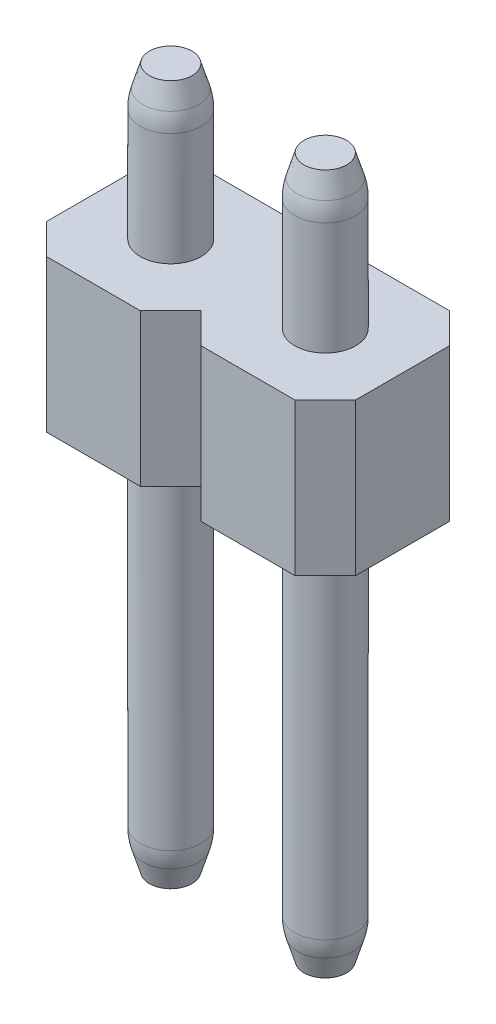
from build123d import *
from OCP.BRepFilletAPI import BRepFilletAPI_MakeChamfer

# Parameters (mm, degrees)
SKETCH1_R               = 0.5
BOSS_EXTRUDE1_DEPTH     = 11.5
BOSS_EXTRUDE1_2_DEPTH   = 11.5
BOSS_EXTRUDE1_3_DEPTH   = 11.5
BOSS_EXTRUDE1_4_DEPTH   = 11.5
BOSS_EXTRUDE1_5_DEPTH   = 11.5
BOSS_EXTRUDE1_6_DEPTH   = 11.5
BOSS_EXTRUDE1_7_DEPTH   = 11.5
BOSS_EXTRUDE1_8_DEPTH   = 11.5
BOSS_EXTRUDE1_9_DEPTH   = 11.5
BOSS_EXTRUDE1_10_DEPTH  = 11.5
BOSS_EXTRUDE1_11_DEPTH  = 11.5
BOSS_EXTRUDE1_12_DEPTH  = 11.5
BOSS_EXTRUDE1_13_DEPTH  = 11.5
BOSS_EXTRUDE1_14_DEPTH  = 11.5
BOSS_EXTRUDE1_15_DEPTH  = 11.5
BOSS_EXTRUDE1_16_DEPTH  = 11.5
BOSS_EXTRUDE2_DEPTH     = 2.5
CHAMFER1_SIZE           = 0.5
CHAMFER1_SIZE2          = 0.15
FILLET1_R               = 1
CHAMFER2_SIZE           = 0.15
CHAMFER2_SIZE2          = 0.5
FILLET2_R               = 1
CUT_EXTRUDE1_DEPTH      = 42.093776929
CUT_EXTRUDE2_DEPTH      = 32.494851997
CUT_EXTRUDE3_DEPTH      = 21.280081417
CUT_EXTRUDE3_DEPTH_BACK = 21.280081417
SKETCH5_W               = 12.7
SKETCH5_H               = 11.5


with BuildPart() as part:
    # Sketch1 → Boss-Extrude1 (new body)
    with BuildSketch(Plane(origin=(0, 0, 0), x_dir=(1, 0, 0), z_dir=(0, 1, 0))):
        with Locations(Location((0, 0, 0), (0, 0, 270))):
            Circle(SKETCH1_R)
    extrude(amount=BOSS_EXTRUDE1_DEPTH)



with BuildPart() as body_2:
    # Sketch1 → Boss-Extrude1 2 (new body)
    with BuildSketch(Plane(origin=(0, 0, 0), x_dir=(1, 0, 0), z_dir=(0, 1, 0))):
        with Locations(Location((2.54, 0, 0), (0, 0, 270))):
            Circle(SKETCH1_R)
    extrude(amount=BOSS_EXTRUDE1_2_DEPTH)


with BuildPart() as body_3:
    # Sketch1 → Boss-Extrude1 3 (new body)
    with BuildSketch(Plane(origin=(0, 0, 0), x_dir=(1, 0, 0), z_dir=(0, 1, 0))):
        with Locations(Location((5.08, 0, 0), (0, 0, 270))):
            Circle(SKETCH1_R)
    extrude(amount=BOSS_EXTRUDE1_3_DEPTH)


with BuildPart() as body_4:
    # Sketch1 → Boss-Extrude1 4 (new body)
    with BuildSketch(Plane(origin=(0, 0, 0), x_dir=(1, 0, 0), z_dir=(0, 1, 0))):
        with Locations(Location((7.62, 0, 0), (0, 0, 270))):
            Circle(SKETCH1_R)
    extrude(amount=BOSS_EXTRUDE1_4_DEPTH)


with BuildPart() as body_5:
    # Sketch1 → Boss-Extrude1 5 (new body)
    with BuildSketch(Plane(origin=(0, 0, 0), x_dir=(1, 0, 0), z_dir=(0, 1, 0))):
        with Locations(Location((10.16, 0, 0), (0, 0, 270))):
            Circle(SKETCH1_R)
    extrude(amount=BOSS_EXTRUDE1_5_DEPTH)


with BuildPart() as body_6:
    # Sketch1 → Boss-Extrude1 6 (new body)
    with BuildSketch(Plane(origin=(0, 0, 0), x_dir=(1, 0, 0), z_dir=(0, 1, 0))):
        with Locations(Location((12.7, 0, 0), (0, 0, 270))):
            Circle(SKETCH1_R)
    extrude(amount=BOSS_EXTRUDE1_6_DEPTH)


with BuildPart() as body_7:
    # Sketch1 → Boss-Extrude1 7 (new body)
    with BuildSketch(Plane(origin=(0, 0, 0), x_dir=(1, 0, 0), z_dir=(0, 1, 0))):
        with Locations(Location((15.24, 0, 0), (0, 0, 270))):
            Circle(SKETCH1_R)
    extrude(amount=BOSS_EXTRUDE1_7_DEPTH)


with BuildPart() as body_8:
    # Sketch1 → Boss-Extrude1 8 (new body)
    with BuildSketch(Plane(origin=(0, 0, 0), x_dir=(1, 0, 0), z_dir=(0, 1, 0))):
        with Locations(Location((17.78, 0, 0), (0, 0, 270))):
            Circle(SKETCH1_R)
    extrude(amount=BOSS_EXTRUDE1_8_DEPTH)


with BuildPart() as body_9:
    # Sketch1 → Boss-Extrude1 9 (new body)
    with BuildSketch(Plane(origin=(0, 0, 0), x_dir=(1, 0, 0), z_dir=(0, 1, 0))):
        with Locations(Location((20.32, 0, 0), (0, 0, 270))):
            Circle(SKETCH1_R)
    extrude(amount=BOSS_EXTRUDE1_9_DEPTH)


with BuildPart() as body_10:
    # Sketch1 → Boss-Extrude1 10 (new body)
    with BuildSketch(Plane(origin=(0, 0, 0), x_dir=(1, 0, 0), z_dir=(0, 1, 0))):
        with Locations(Location((22.86, 0, 0), (0, 0, 270))):
            Circle(SKETCH1_R)
    extrude(amount=BOSS_EXTRUDE1_10_DEPTH)


with BuildPart() as body_11:
    # Sketch1 → Boss-Extrude1 11 (new body)
    with BuildSketch(Plane(origin=(0, 0, 0), x_dir=(1, 0, 0), z_dir=(0, 1, 0))):
        with Locations(Location((25.4, 0, 0), (0, 0, 270))):
            Circle(SKETCH1_R)
    extrude(amount=BOSS_EXTRUDE1_11_DEPTH)


with BuildPart() as body_12:
    # Sketch1 → Boss-Extrude1 12 (new body)
    with BuildSketch(Plane(origin=(0, 0, 0), x_dir=(1, 0, 0), z_dir=(0, 1, 0))):
        with Locations(Location((27.94, 0, 0), (0, 0, 270))):
            Circle(SKETCH1_R)
    extrude(amount=BOSS_EXTRUDE1_12_DEPTH)


with BuildPart() as body_13:
    # Sketch1 → Boss-Extrude1 13 (new body)
    with BuildSketch(Plane(origin=(0, 0, 0), x_dir=(1, 0, 0), z_dir=(0, 1, 0))):
        with Locations(Location((30.48, 0, 0), (0, 0, 270))):
            Circle(SKETCH1_R)
    extrude(amount=BOSS_EXTRUDE1_13_DEPTH)


with BuildPart() as body_14:
    # Sketch1 → Boss-Extrude1 14 (new body)
    with BuildSketch(Plane(origin=(0, 0, 0), x_dir=(1, 0, 0), z_dir=(0, 1, 0))):
        with Locations(Location((33.02, 0, 0), (0, 0, 270))):
            Circle(SKETCH1_R)
    extrude(amount=BOSS_EXTRUDE1_14_DEPTH)


with BuildPart() as body_15:
    # Sketch1 → Boss-Extrude1 15 (new body)
    with BuildSketch(Plane(origin=(0, 0, 0), x_dir=(1, 0, 0), z_dir=(0, 1, 0))):
        with Locations(Location((35.56, 0, 0), (0, 0, 270))):
            Circle(SKETCH1_R)
    extrude(amount=BOSS_EXTRUDE1_15_DEPTH)


with BuildPart() as body_16:
    # Sketch1 → Boss-Extrude1 16 (new body)
    with BuildSketch(Plane(origin=(0, 0, 0), x_dir=(1, 0, 0), z_dir=(0, 1, 0))):
        with Locations(Location((38.1, 0, 0), (0, 0, 270))):
            Circle(SKETCH1_R)
    extrude(amount=BOSS_EXTRUDE1_16_DEPTH)


with BuildPart() as part_1:
    add(part.part)

    add(body_2.part)  # Boss-Extrude2 merges body 2

    add(body_3.part)  # Boss-Extrude2 merges body 3

    add(body_4.part)  # Boss-Extrude2 merges body 4

    add(body_5.part)  # Boss-Extrude2 merges body 5

    add(body_6.part)  # Boss-Extrude2 merges body 6

    add(body_7.part)  # Boss-Extrude2 merges body 7

    add(body_8.part)  # Boss-Extrude2 merges body 8

    add(body_9.part)  # Boss-Extrude2 merges body 9

    add(body_10.part)  # Boss-Extrude2 merges body 10

    add(body_11.part)  # Boss-Extrude2 merges body 11

    add(body_12.part)  # Boss-Extrude2 merges body 12

    add(body_13.part)  # Boss-Extrude2 merges body 13

    add(body_14.part)  # Boss-Extrude2 merges body 14

    add(body_15.part)  # Boss-Extrude2 merges body 15

    add(body_16.part)  # Boss-Extrude2 merges body 16
    # Sketch2 → Boss-Extrude2 (add)
    with BuildSketch(Plane(origin=(0, 6.5, 0), x_dir=(1, 0, 0), z_dir=(0, 1, 0))):
        Polygon((-1.27, 0.77), (-0.77, 1.27), (0.77, 1.27), (1.27, 0.77), (1.77, 1.27), (3.31, 1.27), (3.81, 0.77), (4.31, 1.27), (5.85, 1.27), (6.35, 0.77), (6.85, 1.27), (8.39, 1.27), (8.89, 0.77), (9.39, 1.27), (10.93, 1.27), (11.43, 0.77), (11.93, 1.27), (13.47, 1.27), (13.97, 0.77), (14.47, 1.27), (16.01, 1.27), (16.51, 0.77), (17.01, 1.27), (18.55, 1.27), (19.05, 0.77), (19.55, 1.27), (21.09, 1.27), (21.59, 0.77), (22.09, 1.27), (23.63, 1.27), (24.13, 0.77), (24.63, 1.27), (26.17, 1.27), (26.67, 0.77), (27.17, 1.27), (28.71, 1.27), (29.21, 0.77), (29.71, 1.27), (31.25, 1.27), (31.75, 0.77), (32.25, 1.27), (33.79, 1.27), (34.29, 0.77), (34.79, 1.27), (36.33, 1.27), (36.83, 0.77), (37.33, 1.27), (38.87, 1.27), (39.37, 0.77), (39.37, -0.77), (38.87, -1.27), (37.33, -1.27), (36.83, -0.77), (36.33, -1.27), (34.79, -1.27), (34.29, -0.77), (33.79, -1.27), (32.25, -1.27), (31.75, -0.77), (31.25, -1.27), (29.71, -1.27), (29.21, -0.77), (28.71, -1.27), (27.17, -1.27), (26.67, -0.77), (26.17, -1.27), (24.63, -1.27), (24.13, -0.77), (23.63, -1.27), (22.09, -1.27), (21.59, -0.77), (21.09, -1.27), (19.55, -1.27), (19.05, -0.77), (18.55, -1.27), (17.01, -1.27), (16.51, -0.77), (16.01, -1.27), (14.47, -1.27), (13.97, -0.77), (13.47, -1.27), (11.93, -1.27), (11.43, -0.77), (10.93, -1.27), (9.39, -1.27), (8.89, -0.77), (8.39, -1.27), (6.85, -1.27), (6.35, -0.77), (5.85, -1.27), (4.31, -1.27), (3.81, -0.77), (3.31, -1.27), (1.77, -1.27), (1.27, -0.77), (0.77, -1.27), (-0.77, -1.27), (-1.27, -0.77), align=None)
    extrude(amount=BOSS_EXTRUDE2_DEPTH)

    # Chamfer1: one chamfer whose edges measure the first distance from different faces: ONE call of the kernel's chamfer builder (chamfer() names one face for all edges)
    chamfer1_edges_1 = [part_1.edges().sort_by_distance(p)[0] for p in [
        (2.54, 11.5, -0.5),
    ]]
    chamfer1_side_1 = [part_1.faces().sort_by_distance(p)[0] for p in [
        (2.54, 10.25, -0.5),
    ]]
    chamfer1_edges_2 = [part_1.edges().sort_by_distance(p)[0] for p in [
        (5.08, 11.5, -0.5),
    ]]
    chamfer1_side_2 = [part_1.faces().sort_by_distance(p)[0] for p in [
        (5.08, 10.25, -0.5),
    ]]
    chamfer1_edges_3 = [part_1.edges().sort_by_distance(p)[0] for p in [
        (7.62, 11.5, -0.5),
    ]]
    chamfer1_side_3 = [part_1.faces().sort_by_distance(p)[0] for p in [
        (7.62, 10.25, -0.5),
    ]]
    chamfer1_edges_4 = [part_1.edges().sort_by_distance(p)[0] for p in [
        (10.16, 11.5, -0.5),
    ]]
    chamfer1_side_4 = [part_1.faces().sort_by_distance(p)[0] for p in [
        (10.16, 10.25, -0.5),
    ]]
    chamfer1_edges_5 = [part_1.edges().sort_by_distance(p)[0] for p in [
        (12.7, 11.5, -0.5),
    ]]
    chamfer1_side_5 = [part_1.faces().sort_by_distance(p)[0] for p in [
        (12.7, 10.25, -0.5),
    ]]
    chamfer1_edges_6 = [part_1.edges().sort_by_distance(p)[0] for p in [
        (15.24, 11.5, -0.5),
    ]]
    chamfer1_side_6 = [part_1.faces().sort_by_distance(p)[0] for p in [
        (15.24, 10.25, -0.5),
    ]]
    chamfer1_edges_7 = [part_1.edges().sort_by_distance(p)[0] for p in [
        (17.78, 11.5, -0.5),
    ]]
    chamfer1_side_7 = [part_1.faces().sort_by_distance(p)[0] for p in [
        (17.78, 10.25, -0.5),
    ]]
    chamfer1_edges_8 = [part_1.edges().sort_by_distance(p)[0] for p in [
        (20.32, 11.5, -0.5),
    ]]
    chamfer1_side_8 = [part_1.faces().sort_by_distance(p)[0] for p in [
        (20.32, 10.25, -0.5),
    ]]
    chamfer1_edges_9 = [part_1.edges().sort_by_distance(p)[0] for p in [
        (22.86, 11.5, -0.5),
    ]]
    chamfer1_side_9 = [part_1.faces().sort_by_distance(p)[0] for p in [
        (22.86, 10.25, -0.5),
    ]]
    chamfer1_edges_10 = [part_1.edges().sort_by_distance(p)[0] for p in [
        (25.4, 11.5, -0.5),
    ]]
    chamfer1_side_10 = [part_1.faces().sort_by_distance(p)[0] for p in [
        (25.4, 10.25, -0.5),
    ]]
    chamfer1_edges_11 = [part_1.edges().sort_by_distance(p)[0] for p in [
        (27.94, 11.5, -0.5),
    ]]
    chamfer1_side_11 = [part_1.faces().sort_by_distance(p)[0] for p in [
        (27.94, 10.25, -0.5),
    ]]
    chamfer1_edges_12 = [part_1.edges().sort_by_distance(p)[0] for p in [
        (30.48, 11.5, -0.5),
    ]]
    chamfer1_side_12 = [part_1.faces().sort_by_distance(p)[0] for p in [
        (30.48, 10.25, -0.5),
    ]]
    chamfer1_edges_13 = [part_1.edges().sort_by_distance(p)[0] for p in [
        (33.02, 11.5, -0.5),
    ]]
    chamfer1_side_13 = [part_1.faces().sort_by_distance(p)[0] for p in [
        (33.02, 10.25, -0.5),
    ]]
    chamfer1_edges_14 = [part_1.edges().sort_by_distance(p)[0] for p in [
        (35.56, 11.5, -0.5),
    ]]
    chamfer1_side_14 = [part_1.faces().sort_by_distance(p)[0] for p in [
        (35.56, 10.25, -0.5),
    ]]
    chamfer1_edges_15 = [part_1.edges().sort_by_distance(p)[0] for p in [
        (38.1, 11.5, -0.5),
    ]]
    chamfer1_side_15 = [part_1.faces().sort_by_distance(p)[0] for p in [
        (38.1, 10.25, -0.5),
    ]]
    chamfer1_edges_16 = [part_1.edges().sort_by_distance(p)[0] for p in [
        (0, 11.5, -0.5),
    ]]
    chamfer1_side_16 = [part_1.faces().sort_by_distance(p)[0] for p in [
        (0, 10.25, -0.5),
    ]]
    chamfer1 = BRepFilletAPI_MakeChamfer(part_1.part.solid().wrapped)
    for e in chamfer1_edges_1:
        chamfer1.Add(CHAMFER1_SIZE, CHAMFER1_SIZE2, e.wrapped, chamfer1_side_1[0].wrapped)  # the first distance lies on this face
    for e in chamfer1_edges_2:
        chamfer1.Add(CHAMFER1_SIZE, CHAMFER1_SIZE2, e.wrapped, chamfer1_side_2[0].wrapped)  # the first distance lies on this face
    for e in chamfer1_edges_3:
        chamfer1.Add(CHAMFER1_SIZE, CHAMFER1_SIZE2, e.wrapped, chamfer1_side_3[0].wrapped)  # the first distance lies on this face
    for e in chamfer1_edges_4:
        chamfer1.Add(CHAMFER1_SIZE, CHAMFER1_SIZE2, e.wrapped, chamfer1_side_4[0].wrapped)  # the first distance lies on this face
    for e in chamfer1_edges_5:
        chamfer1.Add(CHAMFER1_SIZE, CHAMFER1_SIZE2, e.wrapped, chamfer1_side_5[0].wrapped)  # the first distance lies on this face
    for e in chamfer1_edges_6:
        chamfer1.Add(CHAMFER1_SIZE, CHAMFER1_SIZE2, e.wrapped, chamfer1_side_6[0].wrapped)  # the first distance lies on this face
    for e in chamfer1_edges_7:
        chamfer1.Add(CHAMFER1_SIZE, CHAMFER1_SIZE2, e.wrapped, chamfer1_side_7[0].wrapped)  # the first distance lies on this face
    for e in chamfer1_edges_8:
        chamfer1.Add(CHAMFER1_SIZE, CHAMFER1_SIZE2, e.wrapped, chamfer1_side_8[0].wrapped)  # the first distance lies on this face
    for e in chamfer1_edges_9:
        chamfer1.Add(CHAMFER1_SIZE, CHAMFER1_SIZE2, e.wrapped, chamfer1_side_9[0].wrapped)  # the first distance lies on this face
    for e in chamfer1_edges_10:
        chamfer1.Add(CHAMFER1_SIZE, CHAMFER1_SIZE2, e.wrapped, chamfer1_side_10[0].wrapped)  # the first distance lies on this face
    for e in chamfer1_edges_11:
        chamfer1.Add(CHAMFER1_SIZE, CHAMFER1_SIZE2, e.wrapped, chamfer1_side_11[0].wrapped)  # the first distance lies on this face
    for e in chamfer1_edges_12:
        chamfer1.Add(CHAMFER1_SIZE, CHAMFER1_SIZE2, e.wrapped, chamfer1_side_12[0].wrapped)  # the first distance lies on this face
    for e in chamfer1_edges_13:
        chamfer1.Add(CHAMFER1_SIZE, CHAMFER1_SIZE2, e.wrapped, chamfer1_side_13[0].wrapped)  # the first distance lies on this face
    for e in chamfer1_edges_14:
        chamfer1.Add(CHAMFER1_SIZE, CHAMFER1_SIZE2, e.wrapped, chamfer1_side_14[0].wrapped)  # the first distance lies on this face
    for e in chamfer1_edges_15:
        chamfer1.Add(CHAMFER1_SIZE, CHAMFER1_SIZE2, e.wrapped, chamfer1_side_15[0].wrapped)  # the first distance lies on this face
    for e in chamfer1_edges_16:
        chamfer1.Add(CHAMFER1_SIZE, CHAMFER1_SIZE2, e.wrapped, chamfer1_side_16[0].wrapped)  # the first distance lies on this face
    add(Compound.cast(chamfer1.Shape()), mode=Mode.REPLACE)

    # Fillet1
    fillet1_edges = [part_1.edges().sort_by_distance(p)[0] for p in [
        (38.1, 11, -0.5),
        (35.56, 11, -0.5),
        (33.02, 11, -0.5),
        (30.48, 11, -0.5),
        (27.94, 11, -0.5),
        (25.4, 11, -0.5),
        (22.86, 11, -0.5),
        (20.32, 11, -0.5),
        (17.78, 11, -0.5),
        (15.24, 11, -0.5),
        (12.7, 11, -0.5),
        (10.16, 11, -0.5),
        (7.62, 11, -0.5),
        (5.08, 11, -0.5),
        (2.54, 11, -0.5),
        (0, 11, -0.5),
    ]]
    fillet(fillet1_edges, radius=FILLET1_R)

    # Chamfer2: one chamfer whose edges measure the first distance from different faces: ONE call of the kernel's chamfer builder (chamfer() names one face for all edges)
    chamfer2_edges_1 = [part_1.edges().sort_by_distance(p)[0] for p in [
        (0, 0, -0.5),
    ]]
    chamfer2_side_1 = [part_1.faces().sort_by_distance(p)[0] for p in [
        (0, 0, 0),
    ]]
    chamfer2_edges_2 = [part_1.edges().sort_by_distance(p)[0] for p in [
        (2.54, 0, -0.5),
    ]]
    chamfer2_side_2 = [part_1.faces().sort_by_distance(p)[0] for p in [
        (2.54, 0, 0),
    ]]
    chamfer2_edges_3 = [part_1.edges().sort_by_distance(p)[0] for p in [
        (5.08, 0, -0.5),
    ]]
    chamfer2_side_3 = [part_1.faces().sort_by_distance(p)[0] for p in [
        (5.08, 0, 0),
    ]]
    chamfer2_edges_4 = [part_1.edges().sort_by_distance(p)[0] for p in [
        (7.62, 0, -0.5),
    ]]
    chamfer2_side_4 = [part_1.faces().sort_by_distance(p)[0] for p in [
        (7.62, 0, 0),
    ]]
    chamfer2_edges_5 = [part_1.edges().sort_by_distance(p)[0] for p in [
        (10.16, 0, -0.5),
    ]]
    chamfer2_side_5 = [part_1.faces().sort_by_distance(p)[0] for p in [
        (10.16, 0, 0),
    ]]
    chamfer2_edges_6 = [part_1.edges().sort_by_distance(p)[0] for p in [
        (12.7, 0, -0.5),
    ]]
    chamfer2_side_6 = [part_1.faces().sort_by_distance(p)[0] for p in [
        (12.7, 0, 0),
    ]]
    chamfer2_edges_7 = [part_1.edges().sort_by_distance(p)[0] for p in [
        (15.24, 0, -0.5),
    ]]
    chamfer2_side_7 = [part_1.faces().sort_by_distance(p)[0] for p in [
        (15.24, 0, 0),
    ]]
    chamfer2_edges_8 = [part_1.edges().sort_by_distance(p)[0] for p in [
        (17.78, 0, -0.5),
    ]]
    chamfer2_side_8 = [part_1.faces().sort_by_distance(p)[0] for p in [
        (17.78, 0, 0),
    ]]
    chamfer2_edges_9 = [part_1.edges().sort_by_distance(p)[0] for p in [
        (20.32, 0, -0.5),
    ]]
    chamfer2_side_9 = [part_1.faces().sort_by_distance(p)[0] for p in [
        (20.32, 0, 0),
    ]]
    chamfer2_edges_10 = [part_1.edges().sort_by_distance(p)[0] for p in [
        (22.86, 0, -0.5),
    ]]
    chamfer2_side_10 = [part_1.faces().sort_by_distance(p)[0] for p in [
        (22.86, 0, 0),
    ]]
    chamfer2_edges_11 = [part_1.edges().sort_by_distance(p)[0] for p in [
        (25.4, 0, -0.5),
    ]]
    chamfer2_side_11 = [part_1.faces().sort_by_distance(p)[0] for p in [
        (25.4, 0, 0),
    ]]
    chamfer2_edges_12 = [part_1.edges().sort_by_distance(p)[0] for p in [
        (27.94, 0, -0.5),
    ]]
    chamfer2_side_12 = [part_1.faces().sort_by_distance(p)[0] for p in [
        (27.94, 0, 0),
    ]]
    chamfer2_edges_13 = [part_1.edges().sort_by_distance(p)[0] for p in [
        (30.48, 0, -0.5),
    ]]
    chamfer2_side_13 = [part_1.faces().sort_by_distance(p)[0] for p in [
        (30.48, 0, 0),
    ]]
    chamfer2_edges_14 = [part_1.edges().sort_by_distance(p)[0] for p in [
        (33.02, 0, -0.5),
    ]]
    chamfer2_side_14 = [part_1.faces().sort_by_distance(p)[0] for p in [
        (33.02, 0, 0),
    ]]
    chamfer2_edges_15 = [part_1.edges().sort_by_distance(p)[0] for p in [
        (35.56, 0, -0.5),
    ]]
    chamfer2_side_15 = [part_1.faces().sort_by_distance(p)[0] for p in [
        (35.56, 0, 0),
    ]]
    chamfer2_edges_16 = [part_1.edges().sort_by_distance(p)[0] for p in [
        (38.1, 0, -0.5),
    ]]
    chamfer2_side_16 = [part_1.faces().sort_by_distance(p)[0] for p in [
        (38.1, 0, 0),
    ]]
    chamfer2 = BRepFilletAPI_MakeChamfer(part_1.part.solid().wrapped)
    for e in chamfer2_edges_1:
        chamfer2.Add(CHAMFER2_SIZE, CHAMFER2_SIZE2, e.wrapped, chamfer2_side_1[0].wrapped)  # the first distance lies on this face
    for e in chamfer2_edges_2:
        chamfer2.Add(CHAMFER2_SIZE, CHAMFER2_SIZE2, e.wrapped, chamfer2_side_2[0].wrapped)  # the first distance lies on this face
    for e in chamfer2_edges_3:
        chamfer2.Add(CHAMFER2_SIZE, CHAMFER2_SIZE2, e.wrapped, chamfer2_side_3[0].wrapped)  # the first distance lies on this face
    for e in chamfer2_edges_4:
        chamfer2.Add(CHAMFER2_SIZE, CHAMFER2_SIZE2, e.wrapped, chamfer2_side_4[0].wrapped)  # the first distance lies on this face
    for e in chamfer2_edges_5:
        chamfer2.Add(CHAMFER2_SIZE, CHAMFER2_SIZE2, e.wrapped, chamfer2_side_5[0].wrapped)  # the first distance lies on this face
    for e in chamfer2_edges_6:
        chamfer2.Add(CHAMFER2_SIZE, CHAMFER2_SIZE2, e.wrapped, chamfer2_side_6[0].wrapped)  # the first distance lies on this face
    for e in chamfer2_edges_7:
        chamfer2.Add(CHAMFER2_SIZE, CHAMFER2_SIZE2, e.wrapped, chamfer2_side_7[0].wrapped)  # the first distance lies on this face
    for e in chamfer2_edges_8:
        chamfer2.Add(CHAMFER2_SIZE, CHAMFER2_SIZE2, e.wrapped, chamfer2_side_8[0].wrapped)  # the first distance lies on this face
    for e in chamfer2_edges_9:
        chamfer2.Add(CHAMFER2_SIZE, CHAMFER2_SIZE2, e.wrapped, chamfer2_side_9[0].wrapped)  # the first distance lies on this face
    for e in chamfer2_edges_10:
        chamfer2.Add(CHAMFER2_SIZE, CHAMFER2_SIZE2, e.wrapped, chamfer2_side_10[0].wrapped)  # the first distance lies on this face
    for e in chamfer2_edges_11:
        chamfer2.Add(CHAMFER2_SIZE, CHAMFER2_SIZE2, e.wrapped, chamfer2_side_11[0].wrapped)  # the first distance lies on this face
    for e in chamfer2_edges_12:
        chamfer2.Add(CHAMFER2_SIZE, CHAMFER2_SIZE2, e.wrapped, chamfer2_side_12[0].wrapped)  # the first distance lies on this face
    for e in chamfer2_edges_13:
        chamfer2.Add(CHAMFER2_SIZE, CHAMFER2_SIZE2, e.wrapped, chamfer2_side_13[0].wrapped)  # the first distance lies on this face
    for e in chamfer2_edges_14:
        chamfer2.Add(CHAMFER2_SIZE, CHAMFER2_SIZE2, e.wrapped, chamfer2_side_14[0].wrapped)  # the first distance lies on this face
    for e in chamfer2_edges_15:
        chamfer2.Add(CHAMFER2_SIZE, CHAMFER2_SIZE2, e.wrapped, chamfer2_side_15[0].wrapped)  # the first distance lies on this face
    for e in chamfer2_edges_16:
        chamfer2.Add(CHAMFER2_SIZE, CHAMFER2_SIZE2, e.wrapped, chamfer2_side_16[0].wrapped)  # the first distance lies on this face
    add(Compound.cast(chamfer2.Shape()), mode=Mode.REPLACE)

    # Fillet2
    fillet2_edges = [part_1.edges().sort_by_distance(p)[0] for p in [
        (10.16, 0.5, -0.5),
        (17.78, 0.5, -0.5),
        (22.86, 0.5, -0.5),
        (27.94, 0.5, -0.5),
        (30.48, 0.5, -0.5),
        (0, 0.5, -0.5),
        (2.54, 0.5, -0.5),
        (5.08, 0.5, -0.5),
        (7.62, 0.5, -0.5),
        (12.7, 0.5, -0.5),
        (15.24, 0.5, -0.5),
        (20.32, 0.5, -0.5),
        (25.4, 0.5, -0.5),
        (33.02, 0.5, -0.5),
        (35.56, 0.5, -0.5),
        (38.1, 0.5, -0.5),
    ]]
    fillet(fillet2_edges, radius=FILLET2_R)

    # Sketch3 → Cut-Extrude1 (cut, through all)
    with BuildSketch(Plane.XY.offset(1.27)):
        Polygon((29.21, 9), (29.21, 6.5), (29.21, -0.904576426), (41.732415353, -0.904576426), (41.732415353, 12.006276544), (29.21, 12.006276544), align=None)
    extrude(amount=-CUT_EXTRUDE1_DEPTH, mode=Mode.SUBTRACT)

    # Sketch4 → Cut-Extrude2 (cut, through all)
    with BuildSketch(Plane.XY.offset(1.27)):
        Polygon((16.51, 9), (16.51, 6.5), (16.51, -1.163081692), (30.596050739, -1.163081692), (30.596050739, 12.130577479), (16.51, 12.130577479), align=None)
    extrude(amount=-CUT_EXTRUDE2_DEPTH, mode=Mode.SUBTRACT)

    # Sketch5 → Cut-Extrude3 (cut, two sides: drawn at the far end of the back side and taken through both)
    with BuildSketch(Plane.XY.offset(1.27).offset(-CUT_EXTRUDE3_DEPTH_BACK)):
        with Locations((10.16, 5.75)):
            Rectangle(SKETCH5_W, SKETCH5_H)
    extrude(amount=CUT_EXTRUDE3_DEPTH + CUT_EXTRUDE3_DEPTH_BACK, mode=Mode.SUBTRACT)


solid = part_1.part
